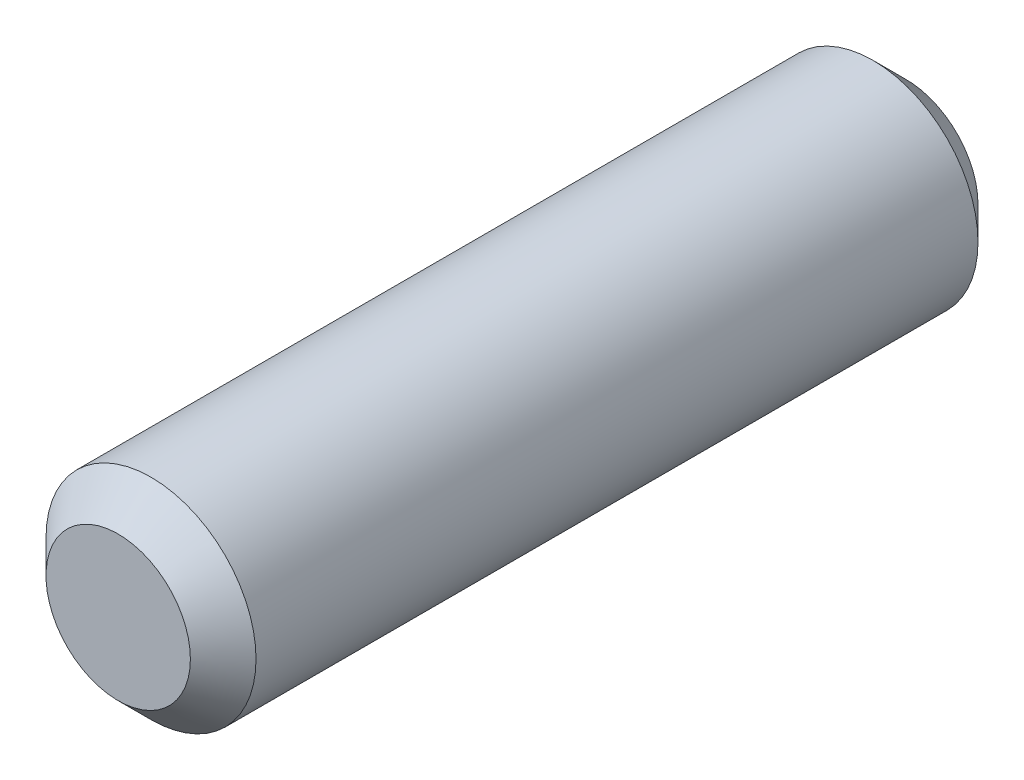
from build123d import *

# Parameters (mm, degrees)
SZKIC1_R                    = 0.8
DODANIE_WYCI_GNI_CIE1_DEPTH = 6
SFAZOWANIE1_SIZE            = 0.25


with BuildPart() as part:
    # Szkic1 → Dodanie-wyciągnięcie1 (new body)
    with BuildSketch(Plane.XY):
        Circle(SZKIC1_R)
    extrude(amount=DODANIE_WYCI_GNI_CIE1_DEPTH)

    # Sfazowanie1
    sfazowanie1_edges = [part.edges().sort_by_distance(p)[0] for p in [
        (-0.8, 0, 0),
        (-0.8, 0, 6),
    ]]
    chamfer(sfazowanie1_edges, length=SFAZOWANIE1_SIZE)


solid = part.part
